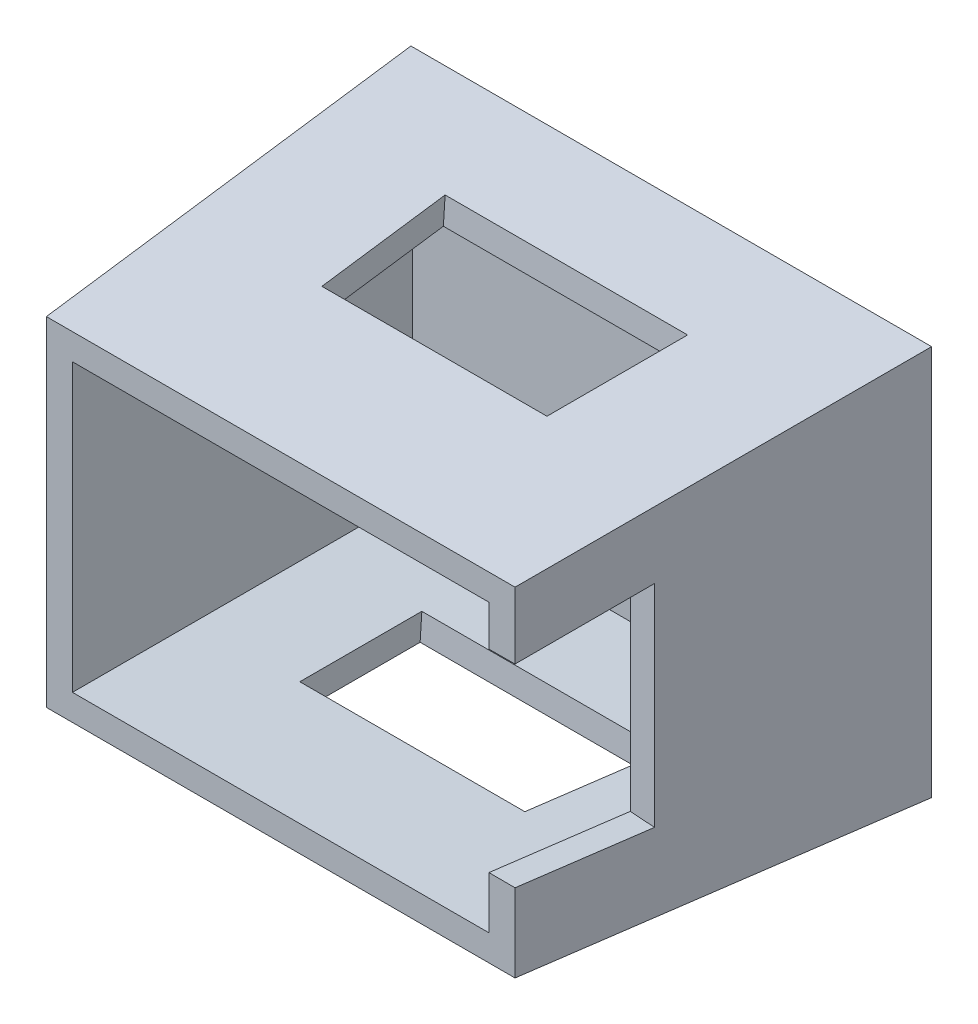
from build123d import *

# Parameters (mm, degrees)
SHELL_1_T           = -2
CUT_EXTRUDE_1_DEPTH = 47.230712485
CUT_EXTRUDE_4_DEPTH = 10


with BuildPart() as part:
    # 草图2 → 放样1 section 0
    with BuildSketch(Plane.XY.offset(30)):
        with BuildLine():
            Line((18, -13), (18, 13))
            Line((18, 13), (-18, 13))
            Line((-18, 13), (-18, -13))
            Line((-18, -13), (18, -13))
        make_face()
    # 草图1 → 放样1 section 1
    with BuildSketch(Plane.XY):
        with BuildLine():
            Line((-20, 15), (20, 15))
            Line((20, 15), (20, -15))
            Line((20, -15), (-20, -15))
            Line((-20, -15), (-20, 15))
        make_face()
    loft()

    # 抽壳1
    shell_1_openings = [part.faces().sort_by_distance(p)[0] for p in [
        (0, 0, 30),
    ]]
    offset(amount=SHELL_1_T, openings=shell_1_openings, kind=Kind.INTERSECTION)

    # 草图3 → 切除-拉伸1 (cut, through all)
    with BuildSketch(Plane(origin=(0, -14.933628319, 0.995575221), x_dir=(1, 0, 0), z_dir=(0, -0.997785157856609, 0.06651901052377396))):
        Polygon((9.31271042, 9.002214842), (8.643090631, 19.068807599), (-8.643090631, 19.068807599), (-9.31271042, 9.002214842), align=None)
    extrude(amount=-CUT_EXTRUDE_1_DEPTH, mode=Mode.SUBTRACT)

    # 草图4 → 切除-拉伸4 (cut)
    with BuildSketch(Plane(origin=(19.911504425, 0, 1.327433628), x_dir=(0.066519010523774, 0, -0.997785157856609), z_dir=(0.997785157856609, 0, 0.066519010523774))):
        Polygon((-31.240874648, -6.83151887), (-18.66961979, -7.667746304), (-18.66961979, 8.556289454), (-31.240874648, 7.720062019), align=None)
    extrude(amount=-CUT_EXTRUDE_4_DEPTH, mode=Mode.SUBTRACT)


solid = part.part
